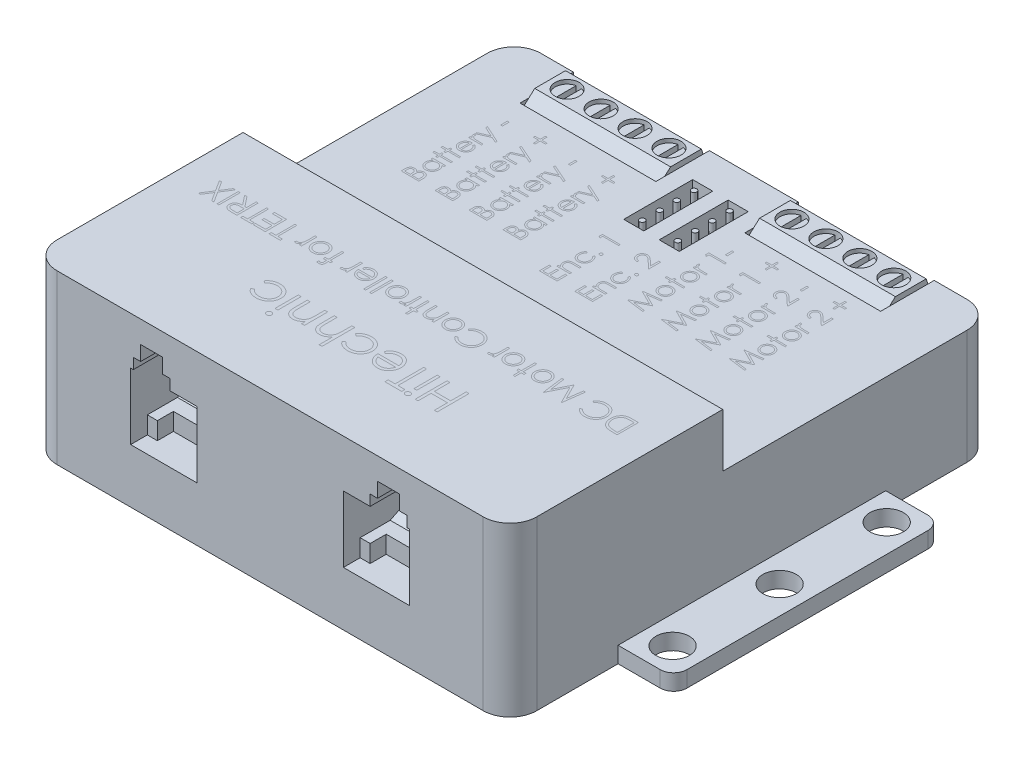
from build123d import *

# Parameters (mm, degrees)
BOSS_EXTRUDE1_DEPTH  = 35.85
SKETCH2_W            = 9.9
SKETCH2_H            = 9.9
CUT_EXTRUDE1_DEPTH   = 13
BOSS_EXTRUDE2_DEPTH  = 9.9
SKETCH3_3_W          = 2.4
SKETCH3_3_H          = 2.6
BOSS_EXTRUDE3_DEPTH  = 1.5
BOSS_EXTRUDE4_START  = 9.9
SKETCH3_4_W          = 2.4
SKETCH3_4_H          = 2.6
BOSS_EXTRUDE4_DEPTH  = 1.5
SKETCH4_W            = 20.3
SKETCH4_H            = 8
CUT_EXTRUDE2_DEPTH   = 9
BOSS_EXTRUDE5_DEPTH  = 20.3
SKETCH6_R            = 1.75
CUT_EXTRUDE3_DEPTH   = 6
CUT_EXTRUDE4_DEPTH   = 0.6
CUT_EXTRUDE5_DEPTH   = 2
SKETCH8_W            = 3
SKETCH8_H            = 10.3
SKETCH8_R            = 0.4
CUT_EXTRUDE6_DEPTH   = 4
SKETCH9_W            = 8.3
SKETCH9_H            = 40
SKETCH9_R            = 2.5
BOSS_EXTRUDE6_DEPTH  = 2.4
FILLET1_R            = 2
FILLET1_OF_MIRROR4_R = 2
FILLET2_R            = 4


with BuildPart() as part:
    # Sketch1 → Boss-Extrude1 (new, symmetric)
    with BuildSketch(Plane(origin=(0, 0, 0), x_dir=(0, 0, -1), z_dir=(1, 0, 0))):
        Polygon((-36.15, 0), (36.15, 0), (36.15, 17.1), (-4.35, 17.1), (-4.35, 25.1), (-36.15, 25.1), align=None)
    extrude(amount=BOSS_EXTRUDE1_DEPTH, both=True)

    # Sketch2 → Cut-Extrude1 (cut)
    with BuildSketch(Plane.XY.offset(36.15)):
        Polygon((14.95, 19.6), (14.95, 18), (20.45, 18), (20.45, 19.6), (19.35, 19.6), (19.35, 21.8), (16.05, 21.8), (16.05, 19.6), align=None)
        with Locations((15.9, 13.05)):
            Rectangle(SKETCH2_W, SKETCH2_H)
    cut_extrude1 = extrude(amount=-CUT_EXTRUDE1_DEPTH, mode=Mode.SUBTRACT)

    # Sketch3 → Boss-Extrude2 (add)
    with BuildSketch(Plane.ZY.offset(-20.85)):
        Polygon((23.15, 8.1), (31.25, 8.1), (31.25, 10.7), (29.15, 10.7), (24.35, 13.1), (24.35, 15.1), (23.15, 15.1), align=None)
    boss_extrude2 = extrude(amount=BOSS_EXTRUDE2_DEPTH)

    # Sketch3<3> → Boss-Extrude3 (add)
    with BuildSketch(Plane.ZY.offset(-20.85)):
        with Locations((32.45, 9.4)):
            Rectangle(SKETCH3_3_W, SKETCH3_3_H)
    boss_extrude3 = extrude(amount=BOSS_EXTRUDE3_DEPTH)

    # Sketch3<4> → Boss-Extrude4 (add)
    with BuildSketch(Plane.ZY.offset(-20.85).offset(BOSS_EXTRUDE4_START)):
        with Locations((32.45, 9.4)):
            Rectangle(SKETCH3_4_W, SKETCH3_4_H)
    boss_extrude4 = extrude(amount=-BOSS_EXTRUDE4_DEPTH)

    # Mirror1: Cut-Extrude1, Boss-Extrude2, Boss-Extrude3, Boss-Extrude4 across plane
    add(cut_extrude1.mirror(Plane(origin=(0, 0, 0), x_dir=(0, 0, 1), z_dir=(1, 0, 0))), mode=Mode.SUBTRACT)
    add(boss_extrude2.mirror(Plane(origin=(0, 0, 0), x_dir=(0, 0, 1), z_dir=(1, 0, 0))))
    add(boss_extrude3.mirror(Plane(origin=(0, 0, 0), x_dir=(0, 0, 1), z_dir=(1, 0, 0))))
    add(boss_extrude4.mirror(Plane(origin=(0, 0, 0), x_dir=(0, 0, 1), z_dir=(1, 0, 0))))

    # Sketch4 → Cut-Extrude2 (cut)
    with BuildSketch(Plane(origin=(0, 17.1, 0), x_dir=(1, 0, 0), z_dir=(0, 1, 0))):
        with Locations((16.8, 32.15)):
            Rectangle(SKETCH4_W, SKETCH4_H)
    cut_extrude2 = extrude(amount=-CUT_EXTRUDE2_DEPTH, mode=Mode.SUBTRACT)

    # Mirror2: Cut-Extrude2 across plane
    add(cut_extrude2.mirror(Plane(origin=(0, 0, 0), x_dir=(0, 0, 1), z_dir=(1, 0, 0))), mode=Mode.SUBTRACT)

    # Sketch8 → Cut-Extrude6 (cut)
    # profile 1 of 2: a face of its own
    with BuildSketch(Plane(origin=(0, 17.1, 0), x_dir=(1, 0, 0), z_dir=(0, 1, 0))):
        with Locations((-2.65, 26)):
            Rectangle(SKETCH8_W, SKETCH8_H)
        with Locations(Location((-2.65, 29.8625, 0), (0, 0, 270))):
            Circle(SKETCH8_R, mode=Mode.SUBTRACT)
        with Locations(Location((-2.65, 27.2875, 0), (0, 0, 270))):
            Circle(SKETCH8_R, mode=Mode.SUBTRACT)
        with Locations(Location((-2.65, 24.7125, 0), (0, 0, 270))):
            Circle(SKETCH8_R, mode=Mode.SUBTRACT)
        with Locations(Location((-2.65, 22.1375, 0), (0, 0, 270))):
            Circle(SKETCH8_R, mode=Mode.SUBTRACT)
    # profile 2 of 2: a face of its own
    with BuildSketch(Plane(origin=(0, 17.1, 0), x_dir=(1, 0, 0), z_dir=(0, 1, 0))):
        with Locations((2.65, 26)):
            Rectangle(SKETCH8_W, SKETCH8_H)
        with Locations(Location((2.65, 22.1375, 0), (0, 0, 270))):
            Circle(SKETCH8_R, mode=Mode.SUBTRACT)
        with Locations(Location((2.65, 24.7125, 0), (0, 0, 270))):
            Circle(SKETCH8_R, mode=Mode.SUBTRACT)
        with Locations(Location((2.65, 27.2875, 0), (0, 0, 270))):
            Circle(SKETCH8_R, mode=Mode.SUBTRACT)
        with Locations(Location((2.65, 29.8625, 0), (0, 0, 270))):
            Circle(SKETCH8_R, mode=Mode.SUBTRACT)
    extrude(amount=-CUT_EXTRUDE6_DEPTH, mode=Mode.SUBTRACT)

    # Sketch9 → Boss-Extrude6 (add)
    with BuildSketch(Plane.XZ):
        with Locations((40, 0)):
            Rectangle(SKETCH9_W, SKETCH9_H)
        with Locations(Location((40, -16, 0), (0, 0, 270))):
            Circle(SKETCH9_R, mode=Mode.SUBTRACT)
        with Locations(Location((40, 0, 0), (0, 0, 270))):
            Circle(SKETCH9_R, mode=Mode.SUBTRACT)
        with Locations(Location((40, 16, 0), (0, 0, 270))):
            Circle(SKETCH9_R, mode=Mode.SUBTRACT)
    boss_extrude6 = extrude(amount=-BOSS_EXTRUDE6_DEPTH)

    # Fillet1
    fillet1_edges = [part.edges().sort_by_distance(p)[0] for p in [
        (44.15, 1.2, 20),
        (44.15, 1.2, -20),
    ]]
    fillet(fillet1_edges, radius=FILLET1_R)

    # Mirror4: Boss-Extrude6 across plane
    add(boss_extrude6.mirror(Plane(origin=(0, 0, 0), x_dir=(0, 0, 1), z_dir=(1, 0, 0))))

    # Fillet1 of Mirror4
    fillet1_of_mirror4_edges = [part.edges().sort_by_distance(p)[0] for p in [
        (-44.15, 1.2, 20),
        (-44.15, 1.2, -20),
    ]]
    fillet(fillet1_of_mirror4_edges, radius=FILLET1_OF_MIRROR4_R)

    # Fillet2
    fillet2_edges = [part.edges().sort_by_distance(p)[0] for p in [
        (-35.85, 12.55, 36.15),
        (35.85, 12.55, 36.15),
        (-35.85, 8.55, -36.15),
        (35.85, 8.55, -36.15),
    ]]
    fillet(fillet2_edges, radius=FILLET2_R)


with BuildPart() as body_2:
    # Sketch5 → Boss-Extrude5 (new body)
    with BuildSketch(Plane(origin=(6.65, 0, 0), x_dir=(0, 0, -1), z_dir=(1, 0, 0))):
        Polygon((36.15, 8.1), (36.15, 14.3), (34.95, 17.9), (30.35, 17.9), (28.15, 15.9), (28.15, 8.1), align=None)
    extrude(amount=BOSS_EXTRUDE5_DEPTH)

    # Sketch6 → Cut-Extrude3 (cut)
    with BuildSketch(Plane(origin=(0, 0, -36.15), x_dir=(-1, 0, 0), z_dir=(0, 0, -1))):
        with Locations((-24.4125, 11.2)):
            Circle(SKETCH6_R)
        with Locations((-19.3375, 11.2)):
            Circle(SKETCH6_R)
        with Locations((-14.2625, 11.2)):
            Circle(SKETCH6_R)
        with Locations((-9.1875, 11.2)):
            Circle(SKETCH6_R)
    extrude(amount=-CUT_EXTRUDE3_DEPTH, mode=Mode.SUBTRACT)

    # Sketch7 → Cut-Extrude4 (cut)
    with BuildSketch(Plane(origin=(0, 17.9, 0), x_dir=(1, 0, 0), z_dir=(0, 1, 0))):
        with BuildLine():
            ThreePointArc((10.9875, 32.65), (10.594624728, 33.772497216), (9.5875, 34.404992877))
            Line((9.5875, 34.404992877), (9.5875, 30.895007123))
            ThreePointArc((9.5875, 30.895007123), (10.594624728, 31.527502784), (10.9875, 32.65))
        make_face()
        with BuildLine():
            Line((8.7875, 30.895007123), (8.7875, 34.404992877))
            ThreePointArc((8.7875, 34.404992877), (7.3875, 32.65), (8.7875, 30.895007123))
        make_face()
        with BuildLine():
            Line((13.8625, 30.895007123), (13.8625, 34.404992877))
            ThreePointArc((13.8625, 34.404992877), (12.4625, 32.65), (13.8625, 30.895007123))
        make_face()
        with BuildLine():
            ThreePointArc((16.0625, 32.65), (15.669624728, 33.772497216), (14.6625, 34.404992877))
            Line((14.6625, 34.404992877), (14.6625, 30.895007123))
            ThreePointArc((14.6625, 30.895007123), (15.669624728, 31.527502784), (16.0625, 32.65))
        make_face()
        with BuildLine():
            ThreePointArc((18.9375, 34.404992877), (17.5375, 32.65), (18.9375, 30.895007123))
            Line((18.9375, 30.895007123), (18.9375, 34.404992877))
        make_face()
        with BuildLine():
            Line((19.7375, 34.404992877), (19.7375, 30.895007123))
            ThreePointArc((19.7375, 30.895007123), (20.744624728, 31.527502784), (21.1375, 32.65))
            ThreePointArc((21.1375, 32.65), (20.744624728, 33.772497216), (19.7375, 34.404992877))
        make_face()
        with BuildLine():
            Line((24.0125, 30.895007123), (24.0125, 34.404992877))
            ThreePointArc((24.0125, 34.404992877), (22.6125, 32.65), (24.0125, 30.895007123))
        make_face()
        with BuildLine():
            ThreePointArc((26.2125, 32.65), (25.819624728, 33.772497216), (24.8125, 34.404992877))
            Line((24.8125, 34.404992877), (24.8125, 30.895007123))
            ThreePointArc((24.8125, 30.895007123), (25.819624728, 31.527502784), (26.2125, 32.65))
        make_face()
    extrude(amount=-CUT_EXTRUDE4_DEPTH, mode=Mode.SUBTRACT)

    # Sketch7<3> → Cut-Extrude5 (cut)
    with BuildSketch(Plane(origin=(0, 17.9, 0), x_dir=(1, 0, 0), z_dir=(0, 1, 0))):
        with BuildLine():
            Line((24.8125, 30.895007123), (24.8125, 34.404992877))
            ThreePointArc((24.8125, 34.404992877), (24.4125, 34.45), (24.0125, 34.404992877))
            Line((24.0125, 34.404992877), (24.0125, 30.895007123))
            ThreePointArc((24.0125, 30.895007123), (24.4125, 30.85), (24.8125, 30.895007123))
        make_face()
        with BuildLine():
            Line((18.9375, 34.404992877), (18.9375, 30.895007123))
            ThreePointArc((18.9375, 30.895007123), (19.3375, 30.85), (19.7375, 30.895007123))
            Line((19.7375, 30.895007123), (19.7375, 34.404992877))
            ThreePointArc((19.7375, 34.404992877), (19.3375, 34.45), (18.9375, 34.404992877))
        make_face()
        with BuildLine():
            ThreePointArc((14.6625, 34.404992877), (14.2625, 34.45), (13.8625, 34.404992877))
            Line((13.8625, 34.404992877), (13.8625, 30.895007123))
            ThreePointArc((13.8625, 30.895007123), (14.2625, 30.85), (14.6625, 30.895007123))
            Line((14.6625, 30.895007123), (14.6625, 34.404992877))
        make_face()
        with BuildLine():
            ThreePointArc((9.5875, 34.404992877), (9.1875, 34.45), (8.7875, 34.404992877))
            Line((8.7875, 34.404992877), (8.7875, 30.895007123))
            ThreePointArc((8.7875, 30.895007123), (9.1875, 30.85), (9.5875, 30.895007123))
            Line((9.5875, 30.895007123), (9.5875, 34.404992877))
        make_face()
    extrude(amount=-CUT_EXTRUDE5_DEPTH, mode=Mode.SUBTRACT)


with BuildPart() as body_3:
    # Mirror3: mirrored copy
    add(body_2.part.mirror(Plane(origin=(0, 0, 0), x_dir=(0, 0, 1), z_dir=(1, 0, 0))))


solid = Compound([part.part, body_2.part, body_3.part])
